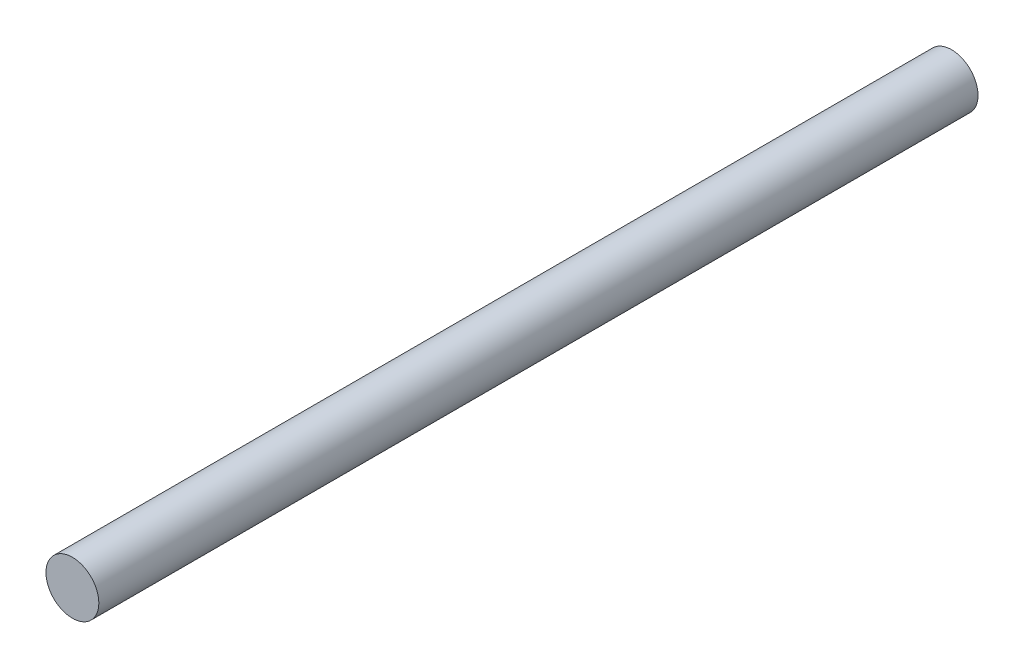
from build123d import *

# Parameters (mm, degrees)
SKETCH1_R           = 3
BOSS_EXTRUDE1_DEPTH = 99.765000114


with BuildPart() as part:
    # Sketch1 → Boss-Extrude1 (new body)
    with BuildSketch(Plane.XY):
        Circle(SKETCH1_R)
    extrude(amount=BOSS_EXTRUDE1_DEPTH)


solid = part.part
